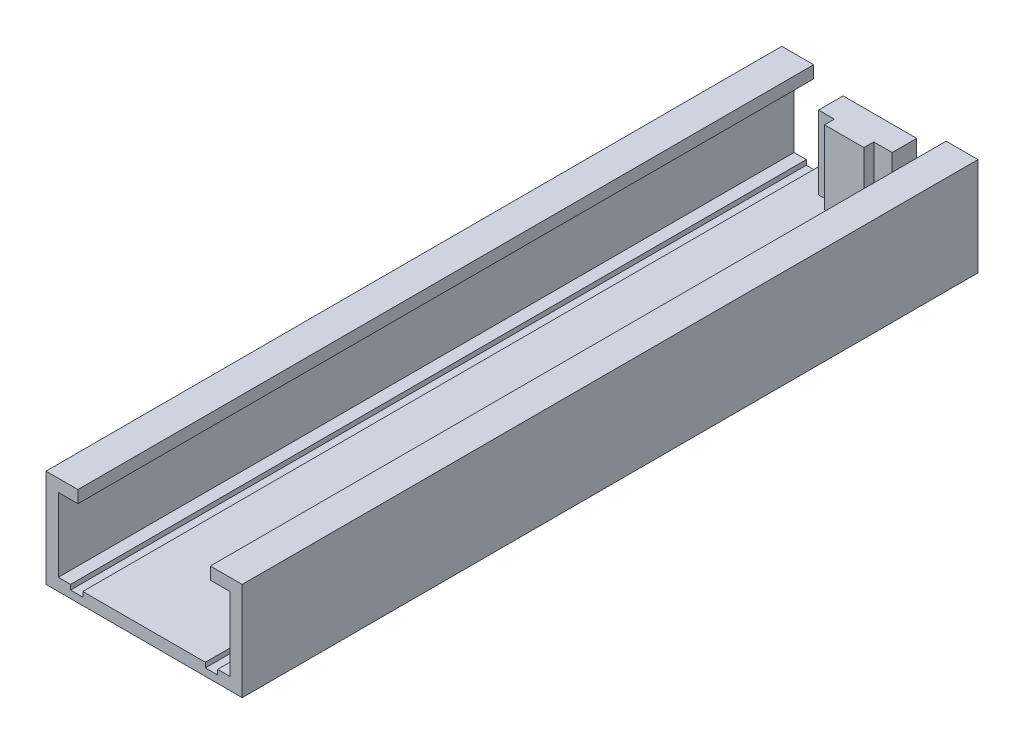
from build123d import *

# Parameters (mm, degrees)
SKETCH_9_W           = 8
SKETCH_9_H           = 4
EXTRUDE_3_DEPTH      = 30
SKETCH_12_W          = 7
SKETCH_12_H          = 3.5
CUT_EXTRUDE_6_DEPTH  = 30
SKETCH_19_W          = 3
SKETCH_19_H          = 1
EXTRUDE_5_DEPTH      = 3
SKETCH_20_W          = 1.605632867
SKETCH_20_H          = 0.400892845
EXTRUDE_6_DEPTH      = 3
SKETCH_22_W          = 0.5
SKETCH_22_H          = 30
CUT_EXTRUDE_7_DEPTH  = 0.2
SKETCH_24_W          = 0.5
SKETCH_24_H          = 30
CUT_EXTRUDE_8_DEPTH  = 0.2
SKETCH_25_R          = 0.457551157
CUT_EXTRUDE_9_DEPTH  = 0.5
SKETCH_26_RX         = 0.496424447
SKETCH_26_RY         = 0.246353064
CUT_EXTRUDE_10_DEPTH = 0.5
SKETCH_27_RX         = 0.374325804
SKETCH_27_RY         = 0.288568922
CUT_EXTRUDE_11_DEPTH = 0.5
SKETCH_28_W          = 0.274311356
SKETCH_28_H          = 4.016178833
CUT_EXTRUDE_12_DEPTH = 0.5
SKETCH_29_W          = 1.237753382
SKETCH_29_H          = 0.3
CUT_EXTRUDE_13_DEPTH = 0.5
SKETCH_31_W          = 0.285973064
SKETCH_31_H          = 3.811928928
CUT_EXTRUDE_14_DEPTH = 0.5
SKETCH_32_W          = 0.8
SKETCH_32_H          = 0.5
EXTRUDE_7_DEPTH      = 30
SKETCH_33_W          = 0.8
SKETCH_33_H          = 0.5
EXTRUDE_8_DEPTH      = 30


with BuildPart() as part:
    # 草圖9 → 填料-伸長3 (new body)
    with BuildSketch(Plane.XY):
        Rectangle(SKETCH_9_W, SKETCH_9_H)
    extrude(amount=EXTRUDE_3_DEPTH)

    # 草圖12 → 除料-伸長6 (cut)
    with BuildSketch(Plane(origin=(0, 0, 0), x_dir=(-1, 0, 0), z_dir=(0, 0, -1))):
        with Locations((0, 0.25)):
            Rectangle(SKETCH_12_W, SKETCH_12_H)
    extrude(amount=-CUT_EXTRUDE_6_DEPTH, mode=Mode.SUBTRACT)

    # 草圖19 → 填料-伸長5 (add)
    with BuildSketch(Plane(origin=(0, -1.5, 0), x_dir=(1, 0, 0), z_dir=(0, 1, 0))):
        with Locations((0, -0.5)):
            Rectangle(SKETCH_19_W, SKETCH_19_H)
    extrude(amount=EXTRUDE_5_DEPTH)

    # 草圖20 → 填料-伸長6 (add)
    with BuildSketch(Plane(origin=(0, -1.5, 0), x_dir=(1, 0, 0), z_dir=(0, 1, 0))):
        with Locations((-0.052553258, -1.200446422)):
            Rectangle(SKETCH_20_W, SKETCH_20_H)
    extrude(amount=EXTRUDE_6_DEPTH)

    # 草圖22 → 除料-伸長7 (cut)
    with BuildSketch(Plane(origin=(0, -1.5, 0), x_dir=(1, 0, 0), z_dir=(0, 1, 0))):
        with Locations((-2.75, -15)):
            Rectangle(SKETCH_22_W, SKETCH_22_H)
    extrude(amount=-CUT_EXTRUDE_7_DEPTH, mode=Mode.SUBTRACT)

    # 草圖24 → 除料-伸長8 (cut)
    with BuildSketch(Plane(origin=(0, -1.5, 0), x_dir=(1, 0, 0), z_dir=(0, 1, 0))):
        with Locations((2.747295887, -15)):
            Rectangle(SKETCH_24_W, SKETCH_24_H)
    extrude(amount=-CUT_EXTRUDE_8_DEPTH, mode=Mode.SUBTRACT)

    # 草圖25 → 除料-伸長9 (cut)
    with BuildSketch(Plane(origin=(0, -1.5, 0), x_dir=(1, 0, 0), z_dir=(0, 1, 0))):
        with Locations(Location((0, -3.470601741, 0), (0, 0, 270))):
            Circle(SKETCH_25_R)
    extrude(amount=-CUT_EXTRUDE_9_DEPTH, mode=Mode.SUBTRACT)

    # 草圖26 → 除料-伸長10 (cut)
    with BuildSketch(Plane(origin=(0, -1.5, 0), x_dir=(1, 0, 0), z_dir=(0, 1, 0))):
        with Locations(Location((0, -8.0522519), (0, 0, 90))):
            Ellipse(SKETCH_26_RX, SKETCH_26_RY)
    extrude(amount=-CUT_EXTRUDE_10_DEPTH, mode=Mode.SUBTRACT)

    # 草圖27 → 除料-伸長11 (cut)
    with BuildSketch(Plane(origin=(0, -1.5, 0), x_dir=(1, 0, 0), z_dir=(0, 1, 0))):
        with Locations(Location((0, -9.480269605), (0, 0, 90))):
            Ellipse(SKETCH_27_RX, SKETCH_27_RY)
    extrude(amount=-CUT_EXTRUDE_11_DEPTH, mode=Mode.SUBTRACT)

    # 草圖28 → 除料-伸長12 (cut)
    with BuildSketch(Plane(origin=(0, -1.5, 0), x_dir=(1, 0, 0), z_dir=(0, 1, 0))):
        with Locations((0.731907804, -8.669902249)):
            Rectangle(SKETCH_28_W, SKETCH_28_H)
    extrude(amount=-CUT_EXTRUDE_12_DEPTH, mode=Mode.SUBTRACT)

    # 草圖29 → 除料-伸長13 (cut)
    with BuildSketch(Plane(origin=(0, -1.5, 0), x_dir=(1, 0, 0), z_dir=(0, 1, 0))):
        with Locations((-0.024124565, -6.811812832)):
            Rectangle(SKETCH_29_W, SKETCH_29_H)
    extrude(amount=-CUT_EXTRUDE_13_DEPTH, mode=Mode.SUBTRACT)

    # 草圖31 → 除料-伸長14 (cut)
    with BuildSketch(Plane(origin=(0, -1.5, 0), x_dir=(1, 0, 0), z_dir=(0, 1, 0))):
        with Locations((-0.500014724, -8.867777296)):
            Rectangle(SKETCH_31_W, SKETCH_31_H)
    extrude(amount=-CUT_EXTRUDE_14_DEPTH, mode=Mode.SUBTRACT)

    # 草圖32 → 填料-伸長7 (add)
    with BuildSketch(Plane(origin=(0, 0, 0), x_dir=(-1, 0, 0), z_dir=(0, 0, -1))):
        with Locations((-3.1, 1.75)):
            Rectangle(SKETCH_32_W, SKETCH_32_H)
    extrude(amount=-EXTRUDE_7_DEPTH)

    # 草圖33 → 填料-伸長8 (add)
    with BuildSketch(Plane(origin=(0, 0, 0), x_dir=(-1, 0, 0), z_dir=(0, 0, -1))):
        with Locations((3.1, 1.75)):
            Rectangle(SKETCH_33_W, SKETCH_33_H)
    extrude(amount=-EXTRUDE_8_DEPTH)


solid = part.part
